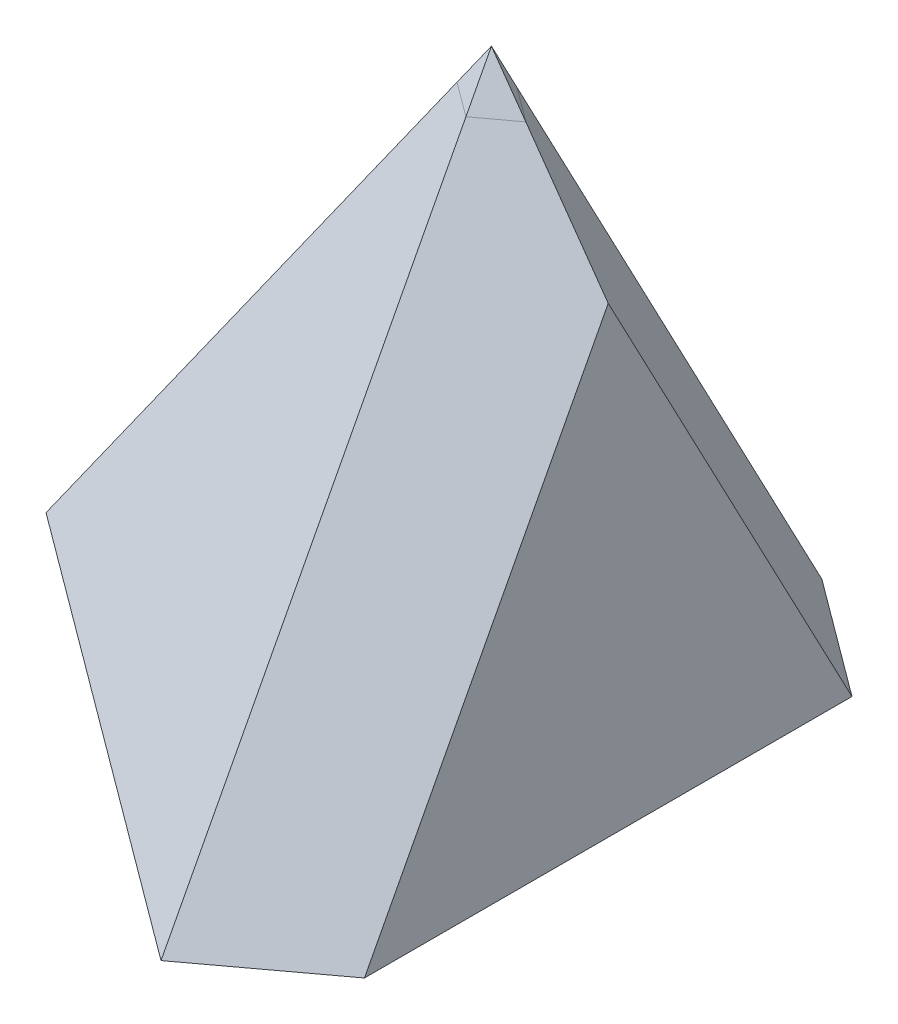
from build123d import *

# Parameters (mm, degrees)
CUT_EXTRUDE_1_DEPTH = 10
SKETCH_8_R          = 0.268132752
EXTRUDE_2_DEPTH     = 1
CUT_EXTRUDE_2_DEPTH = 1449.775057994


with BuildPart() as part:
    # 草图4 → 放样9 section 0
    with BuildSketch(Plane(origin=(0, -35.179389088, 0), x_dir=(-1, 0, 0), z_dir=(0, -1, 0)), mode=Mode.PRIVATE) as loft_9_s0:
        with BuildLine():
            Line((0, 44.121114102), (59.554648117, 0))
            Line((59.554648117, 0), (0, -44.121114102))
            Line((0, -44.121114102), (-59.554648117, 0))
            Line((-59.554648117, 0), (0, 44.121114102))
        make_face()
    loft([loft_9_s0.sketch, Vertex(0, 48.62214178, 0)])

    # 草图7 → 切除-拉伸1 (cut)
    with BuildSketch(Plane(origin=(0, 47.62214178, 0), x_dir=(-1, 0, 0), z_dir=(0, -1, 0))):
        Polygon((0, -44.121114102), (59.554648117, 0), (0, 44.121114102), (-59.554648117, 0), align=None)
    extrude(amount=-CUT_EXTRUDE_1_DEPTH, mode=Mode.SUBTRACT)

    # 草图8 → 凸台-拉伸2 (add)
    with BuildSketch(Plane(origin=(0, 47.62214178, 0), x_dir=(-1, 0, 0), z_dir=(0, -1, 0))):
        with Locations(Location((0, 0, 0), (0, 0, 90))):
            Circle(SKETCH_8_R)
    extrude(amount=-EXTRUDE_2_DEPTH)

    # 草图9 → section 0 of loft_10
    with BuildSketch(Plane(origin=(0, -1036.37785822, 0), x_dir=(-1, 0, 0), z_dir=(0, -1, 0)), mode=Mode.PRIVATE) as loft_10_s0:
        with BuildLine():
            Line((771.069365179, 0), (0, -571.993183946))
            Line((0, -571.993183946), (-771.069365179, 0))
            Line((-771.069365179, 0), (0, 571.993183946))
            Line((0, 571.993183946), (771.069365179, 0))
        make_face()
    # loft up to a face of the part (loft_10)
    loft([loft_10_s0.sketch, part.faces().sort_by_distance((0, -35.179389088, 0))[0]])

    # 草图10 → 切除-拉伸2 (cut, through all)
    with BuildSketch(Plane(origin=(0, -1036.37785822, 0), x_dir=(-1, 0, 0), z_dir=(0, -1, 0))):
        Polygon((-202.2, 0), (-202.2, 421.997571337), (-771.069365179, 0), (-202.2, -421.997571337), align=None)
    extrude(amount=-CUT_EXTRUDE_2_DEPTH, mode=Mode.SUBTRACT)


solid = part.part
